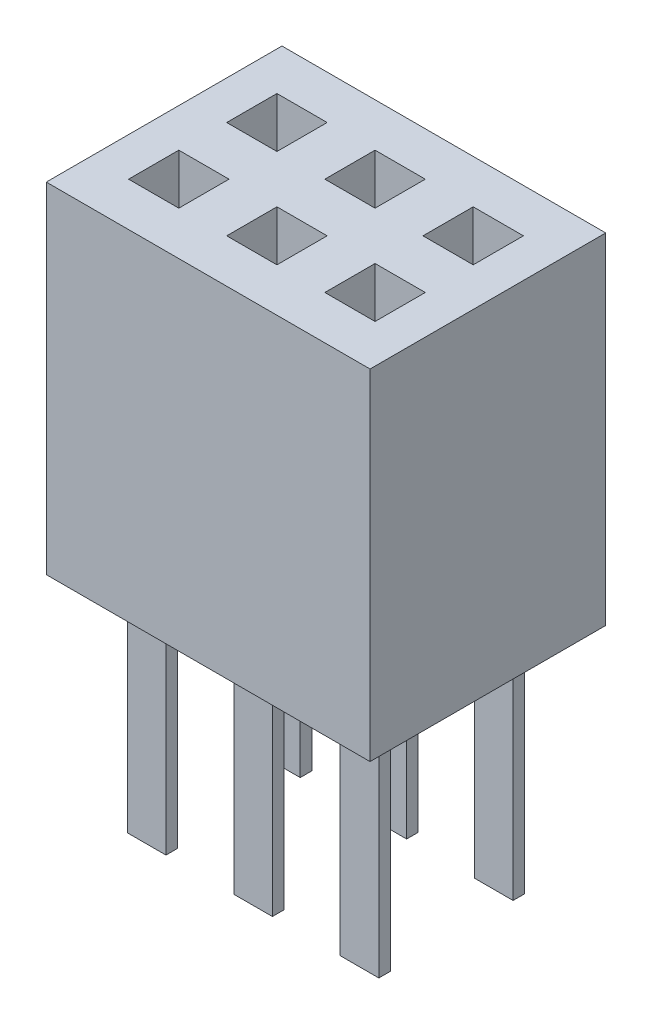
from build123d import *

# Parameters (mm, degrees)
ESQUISSE2_W             = 4.19
ESQUISSE2_H             = 3.05
BOSS_EXTRU_1_DEPTH      = 4.4
ESQUISSE4_W             = 0.65
ESQUISSE4_H             = 0.65
ENL_V_MAT_EXTRU_1_DEPTH = 3.5
ESQUISSE5_W             = 0.5
ESQUISSE5_H             = 0.15
BOSS_EXTRU_2_DEPTH      = 3
CHANFREIN1_SIZE         = 0.05


with BuildPart() as part:
    # Esquisse2 → Boss.-Extru.1 (new body)
    with BuildSketch(Plane(origin=(0, 0, 0), x_dir=(1, 0, 0), z_dir=(0, 1, 0))):
        Rectangle(ESQUISSE2_W, ESQUISSE2_H)
    extrude(amount=BOSS_EXTRU_1_DEPTH)

    # Esquisse4 → Enlèv. mat.-Extru.1 (cut)
    with BuildSketch(Plane(origin=(0, 4.4, 0), x_dir=(1, 0, 0), z_dir=(0, 1, 0))):
        with Locations((-1.27, 0.635)):
            Rectangle(ESQUISSE4_W, ESQUISSE4_H)
        with Locations((0, 0.635)):
            Rectangle(ESQUISSE4_W, ESQUISSE4_H)
        with Locations((1.27, 0.635)):
            Rectangle(ESQUISSE4_W, ESQUISSE4_H)
        with Locations((-1.27, -0.635)):
            Rectangle(ESQUISSE4_W, ESQUISSE4_H)
        with Locations((0, -0.635)):
            Rectangle(ESQUISSE4_W, ESQUISSE4_H)
        with Locations((1.27, -0.635)):
            Rectangle(ESQUISSE4_W, ESQUISSE4_H)
    extrude(amount=-ENL_V_MAT_EXTRU_1_DEPTH, mode=Mode.SUBTRACT)

    # Esquisse5 → Boss.-Extru.2 (add)
    with BuildSketch(Plane.XZ):
        with Locations((-1.377426973, 0.868741936)):
            Rectangle(ESQUISSE5_W, ESQUISSE5_H)
        with Locations((0, 0.868741936)):
            Rectangle(ESQUISSE5_W, ESQUISSE5_H)
        with Locations((1.377426973, 0.868741936)):
            Rectangle(ESQUISSE5_W, ESQUISSE5_H)
        with Locations((-1.377426973, -0.868741936)):
            Rectangle(ESQUISSE5_W, ESQUISSE5_H)
        with Locations((0, -0.868741936)):
            Rectangle(ESQUISSE5_W, ESQUISSE5_H)
        with Locations((1.377426973, -0.868741936)):
            Rectangle(ESQUISSE5_W, ESQUISSE5_H)
    extrude(amount=BOSS_EXTRU_2_DEPTH)

    # Chanfrein1
    chanfrein1_edges = [part.edges().sort_by_distance(p)[0] for p in [
        (0.25, -3, 0.868741936),
        (0, -3, 0.943741936),
        (-0.25, -3, 0.868741936),
        (0, -3, 0.793741936),
        (1.627426973, -3, 0.868741936),
        (1.377426973, -3, 0.943741936),
        (1.127426973, -3, 0.868741936),
        (1.377426973, -3, 0.793741936),
        (-1.127426973, -3, -0.868741936),
        (-1.377426973, -3, -0.793741936),
        (-1.627426973, -3, -0.868741936),
        (-1.377426973, -3, -0.943741936),
        (0.25, -3, -0.868741936),
        (0, -3, -0.793741936),
        (-0.25, -3, -0.868741936),
        (0, -3, -0.943741936),
        (1.627426973, -3, -0.868741936),
        (1.377426973, -3, -0.793741936),
        (1.127426973, -3, -0.868741936),
        (1.377426973, -3, -0.943741936),
        (-1.127426973, -3, 0.868741936),
        (-1.377426973, -3, 0.943741936),
        (-1.627426973, -3, 0.868741936),
        (-1.377426973, -3, 0.793741936),
    ]]
    chamfer(chanfrein1_edges, length=CHANFREIN1_SIZE)


solid = part.part
